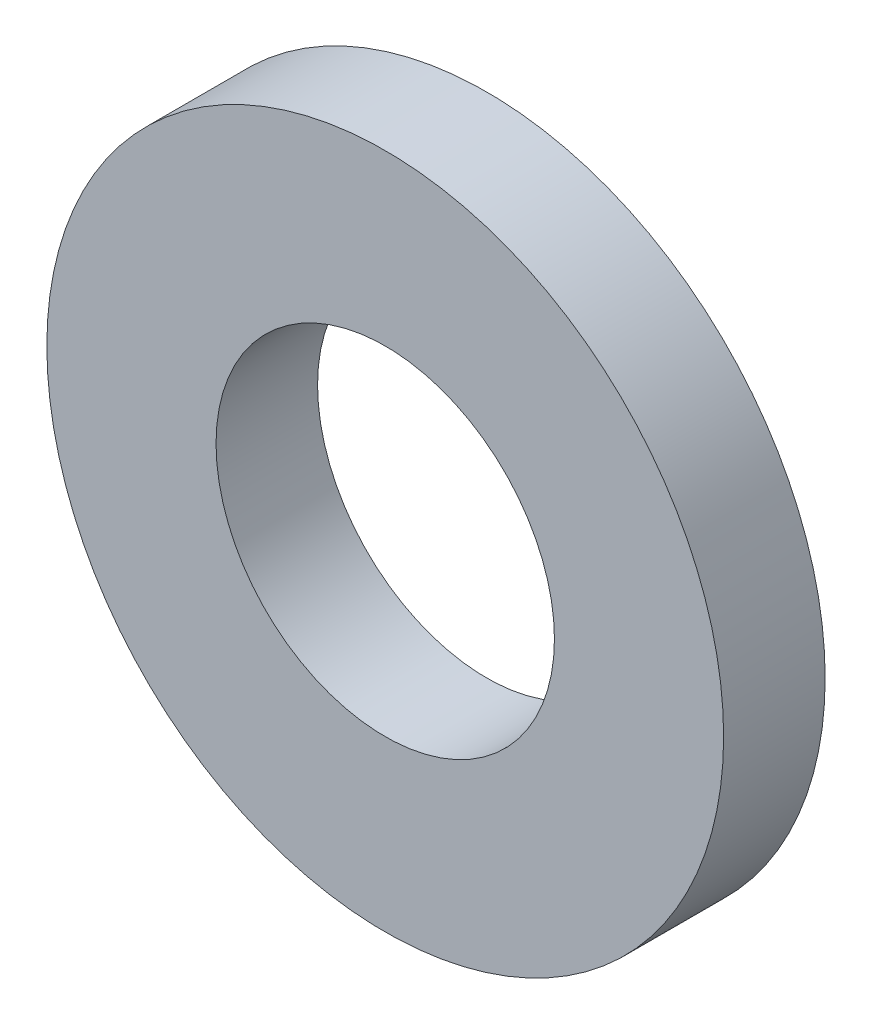
from build123d import *

# Parameters (mm, degrees)
ESQUISSE1_R        = 4
ESQUISSE1_R_2      = 2
BOSS_EXTRU_1_DEPTH = 1.2


with BuildPart() as part:
    # Esquisse1 → Boss.-Extru.1 (new body)
    with BuildSketch(Plane.XY):
        Circle(ESQUISSE1_R)
        Circle(ESQUISSE1_R_2, mode=Mode.SUBTRACT)
    extrude(amount=BOSS_EXTRU_1_DEPTH)


solid = part.part
